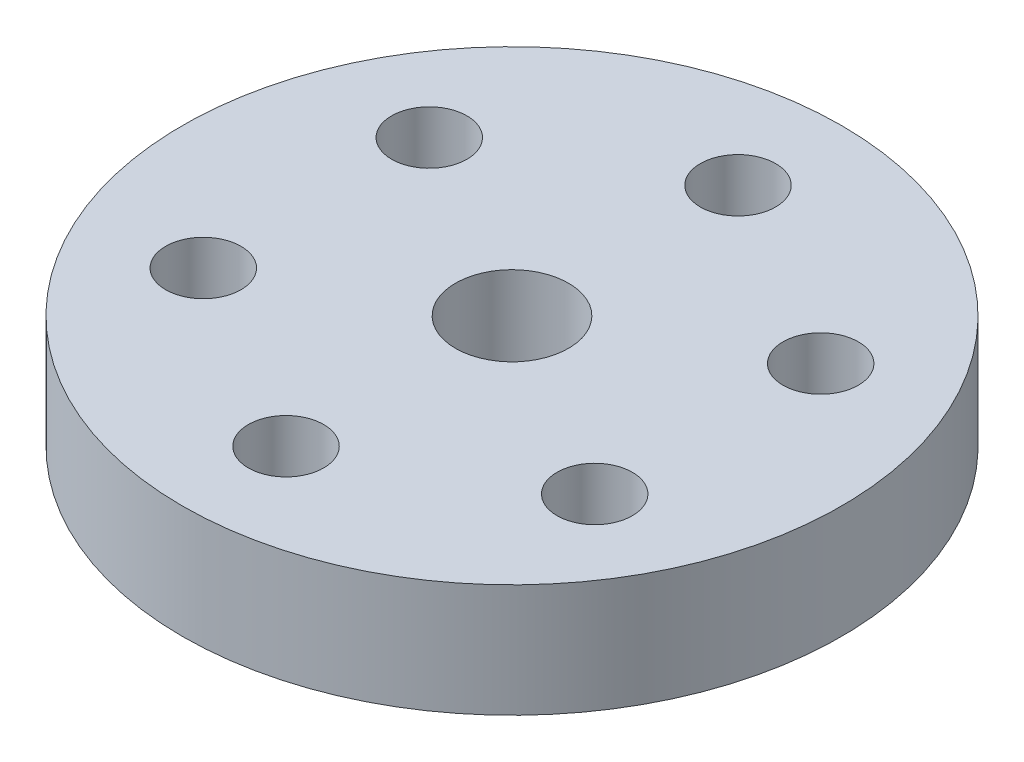
from build123d import *

# Parameters (mm, degrees)
SKETCH_1_R      = 17.5
SKETCH_1_R_2    = 2
SKETCH_1_R_3    = 3
EXTRUDE_1_DEPTH = 6


with BuildPart() as part:
    # 草图1 → 凸台-拉伸1 (new body)
    with BuildSketch(Plane(origin=(0, 0, 0), x_dir=(1, 0, 0), z_dir=(0, 1, 0))):
        with Locations(Location((0, 0, 0), (0, 0, 270))):
            Circle(SKETCH_1_R)
        with Locations(Location((0, 12, 0), (0, 0, 270))):
            Circle(SKETCH_1_R_2, mode=Mode.SUBTRACT)
        with Locations(Location((10.392304845, 6, 0), (0, 0, 270))):
            Circle(SKETCH_1_R_2, mode=Mode.SUBTRACT)
        with Locations(Location((10.392304845, -6, 0), (0, 0, 270))):
            Circle(SKETCH_1_R_2, mode=Mode.SUBTRACT)
        with Locations(Location((0, -12, 0), (0, 0, 270))):
            Circle(SKETCH_1_R_2, mode=Mode.SUBTRACT)
        with Locations(Location((-10.392304845, -6, 0), (0, 0, 270))):
            Circle(SKETCH_1_R_2, mode=Mode.SUBTRACT)
        with Locations(Location((-10.392304845, 6, 0), (0, 0, 270))):
            Circle(SKETCH_1_R_2, mode=Mode.SUBTRACT)
        with Locations(Location((0, 0, 0), (0, 0, 270))):
            Circle(SKETCH_1_R_3, mode=Mode.SUBTRACT)
    extrude(amount=EXTRUDE_1_DEPTH)


solid = part.part
